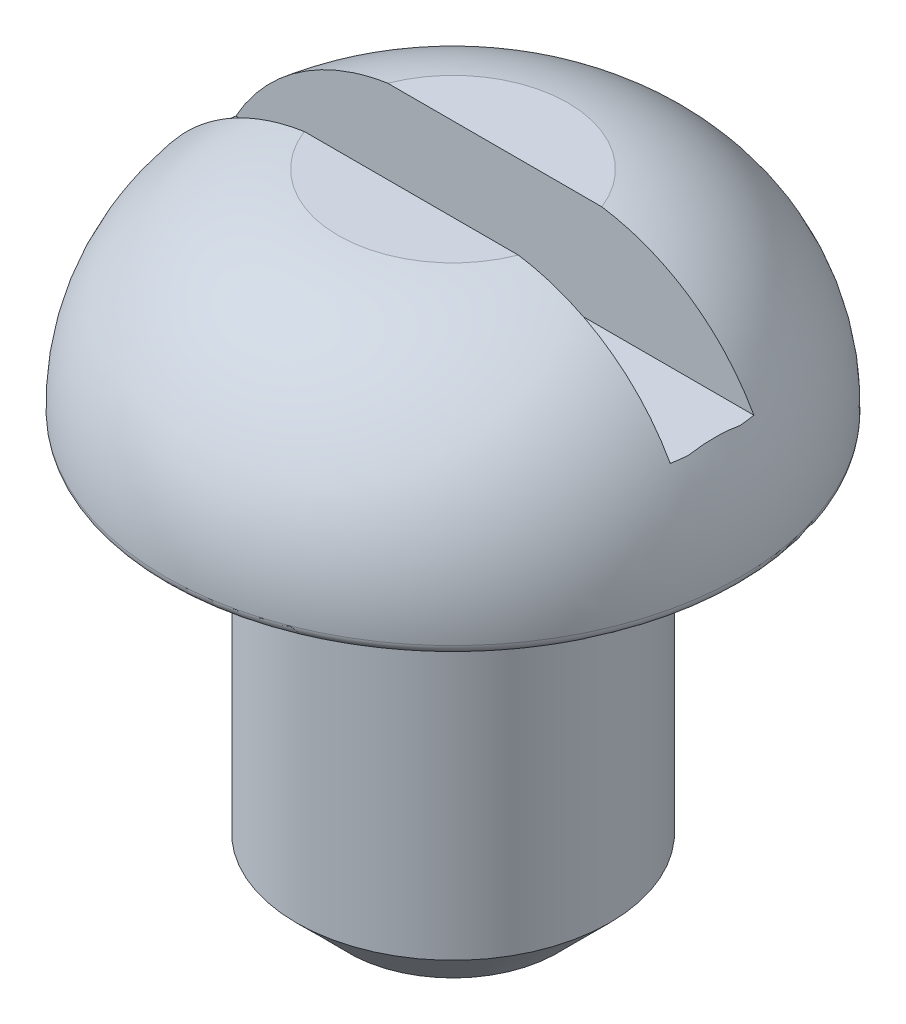
from build123d import *

# Parameters (mm, degrees)
FILLET_1_R          = 0.1
SKETCH_3_W          = 5
SKETCH_3_H          = 0.8
CUT_EXTRUDE_2_DEPTH = 1


with BuildPart() as part:
    # Эскиз1 → Повернуть1 (revolve)
    with BuildSketch(Plane.XY):
        with BuildLine():
            Line((2.75, 3.9), (1.5, 3.9))
            Line((1.5, 3.9), (1.5, 0.5))
            Line((1.5, 0.5), (1, 0))
            Line((1, 0), (0, 0))
            Line((0, 0), (0, 6))
            Line((0, 6), (1.1, 6))
            ThreePointArc((1.1, 6), (2.333466256, 5.270937772), (2.75, 3.9))
        make_face()
    revolve(axis=Axis((0, 0, 0), (0, 1, 0)))

    # Скругление1
    fillet_1_edges = [part.edges().sort_by_distance(p)[0] for p in [
        (-2.75, 3.9, 0),
    ]]
    fillet(fillet_1_edges, radius=FILLET_1_R)

    # Эскиз3 → Вырез-Вытянуть2 (cut)
    with BuildSketch(Plane(origin=(0, 6, 0), x_dir=(-1, 0, 0), z_dir=(0, 1, 0))):
        Rectangle(SKETCH_3_W, SKETCH_3_H)
    extrude(amount=-CUT_EXTRUDE_2_DEPTH, mode=Mode.SUBTRACT)


solid = part.part
